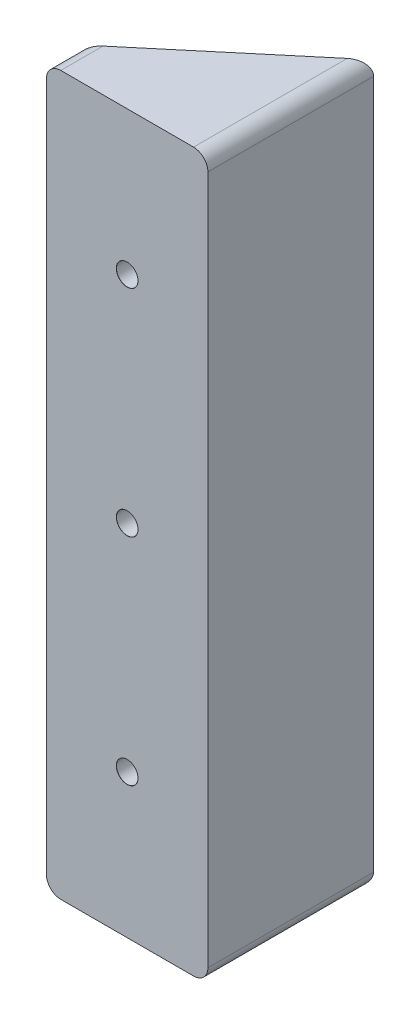
from build123d import *

# Parameters (mm, degrees)
SKETCH1_W                      = 45
SKETCH1_H                      = 200
BOSS_EXTRUDE1_DEPTH            = 500
FILLET1_R                      = 4
CUT_EXTRUDE3_DEPTH             = 540.418860697
CUT_EXTRUDE3_DEPTH_BACK        = 540.418860697
CUT_EXTRUDE4_DEPTH             = 540.418860697
CUT_EXTRUDE4_DEPTH_BACK        = 540.418860697
CUT_EXTRUDE5_DEPTH             = 540.418860697
CUT_EXTRUDE5_DEPTH_BACK        = 540.418860697
CUT_EXTRUDE7_DEPTH             = 540.418860697
CUT_EXTRUDE7_DEPTH_BACK        = 540.418860697
F_6_0MM_DOWEL_SLOT_D           = 6
F_6_0MM_DOWEL_SLOT_DEPTH       = 128.197418143
F_6_0MM_DOWEL_SLOT_CSINK_D     = 6.05
F_6_0MM_DOWEL_SLOT_CSINK_ANGLE = 90
F_6_0MM_DOWEL_SLOT_TIP         = 1.802581857


with BuildPart() as part:
    # Sketch1 → Boss-Extrude1 (new body)
    with BuildSketch(Plane.XY):
        with Locations((-8.688255411, 34.272684877)):
            Rectangle(SKETCH1_W, SKETCH1_H)
    extrude(amount=BOSS_EXTRUDE1_DEPTH)

    # Fillet1
    fillet1_edges = [part.edges().sort_by_distance(p)[0] for p in [
        (13.811744589, 134.272684877, 250),
        (13.811744589, -65.727315123, 250),
        (-31.188255411, -65.727315123, 250),
        (-31.188255411, 134.272684877, 250),
    ]]
    fillet(fillet1_edges, radius=FILLET1_R)

    # Sketch4 → Cut-Extrude3 (cut, two sides: drawn at the far end of the back side and taken through both)
    with BuildSketch(Plane(origin=(0, 134.272684877, 0), x_dir=(1, 0, 0), z_dir=(0, 1, 0)).offset(-CUT_EXTRUDE3_DEPTH_BACK)):
        Polygon((-954.529416546, -60.37823327), (-31.188255411, -479.570237952), (13.811744589, -500), (937.152905724, -919.192004683), (98.768896358, -2765.874326953), (-1792.913425912, -1907.060555539), align=None)
    extrude(amount=CUT_EXTRUDE3_DEPTH + CUT_EXTRUDE3_DEPTH_BACK, mode=Mode.SUBTRACT)

    # Sketch5 → Cut-Extrude4 (cut, two sides: drawn at the far end of the back side and taken through both)
    with BuildSketch(Plane(origin=(0, 134.272684877, 0), x_dir=(1, 0, 0), z_dir=(0, 1, 0)).offset(-CUT_EXTRUDE4_DEPTH_BACK)):
        Polygon((781.934937979, 662.017821823), (13.811744589, 0), (-31.188255411, -38.7838855), (-799.311448802, -700.801707323), (-2123.347092448, 835.444679459), (-542.100705666, 2198.264208604), align=None)
    extrude(amount=CUT_EXTRUDE4_DEPTH + CUT_EXTRUDE4_DEPTH_BACK, mode=Mode.SUBTRACT)

    # Sketch6 → Cut-Extrude5 (cut, two sides: drawn at the far end of the back side and taken through both)
    with BuildSketch(Plane(origin=(0, 134.272684877, 0), x_dir=(1, 0, 0), z_dir=(0, 1, 0)).offset(-CUT_EXTRUDE5_DEPTH_BACK)):
        Polygon((-806.445941811, -689.253490297), (-31.188255411, -38.7838855), (13.811744589, -1.027236672), (789.069430988, 649.442368125), (-511.869778607, 2199.957740924), (-2107.385151405, 861.261882502), align=None)
    extrude(amount=CUT_EXTRUDE5_DEPTH + CUT_EXTRUDE5_DEPTH_BACK, mode=Mode.SUBTRACT)

    # Sketch7 → Cut-Extrude7 (cut, two sides: drawn at the far end of the back side and taken through both)
    with BuildSketch(Plane(origin=(0, -65.727315123, 0), x_dir=(-1, 0, 0), z_dir=(0, -1, 0)).offset(-CUT_EXTRUDE7_DEPTH_BACK)):
        Polygon((951.279102129, -47.185095961), (31.188255411, -47.185095961), (-13.811744589, -47.185095961), (-933.902591306, -47.185095961), (-933.902591306, -1887.366789396), (951.279102129, -1887.366789396), align=None)
    extrude(amount=CUT_EXTRUDE7_DEPTH + CUT_EXTRUDE7_DEPTH_BACK, mode=Mode.SUBTRACT)

    # Ø6.0mm Dowel Slot
    with Locations(Plane(origin=(1239.161696342, 134.272684877, 47.185095961), x_dir=(-1, 0, 0), z_dir=(0, 0, 1))):
        with Locations((1247.849951753, 160), (1247.849951753, 100), (1247.849951753, 40)):
            CounterSinkHole(F_6_0MM_DOWEL_SLOT_D / 2, F_6_0MM_DOWEL_SLOT_CSINK_D / 2, depth=F_6_0MM_DOWEL_SLOT_DEPTH, counter_sink_angle=F_6_0MM_DOWEL_SLOT_CSINK_ANGLE)
            with Locations((0, 0, -(F_6_0MM_DOWEL_SLOT_DEPTH + F_6_0MM_DOWEL_SLOT_TIP / 2))):  # 118° drill point
                Cone(0, F_6_0MM_DOWEL_SLOT_D / 2, F_6_0MM_DOWEL_SLOT_TIP, mode=Mode.SUBTRACT)


solid = part.part
